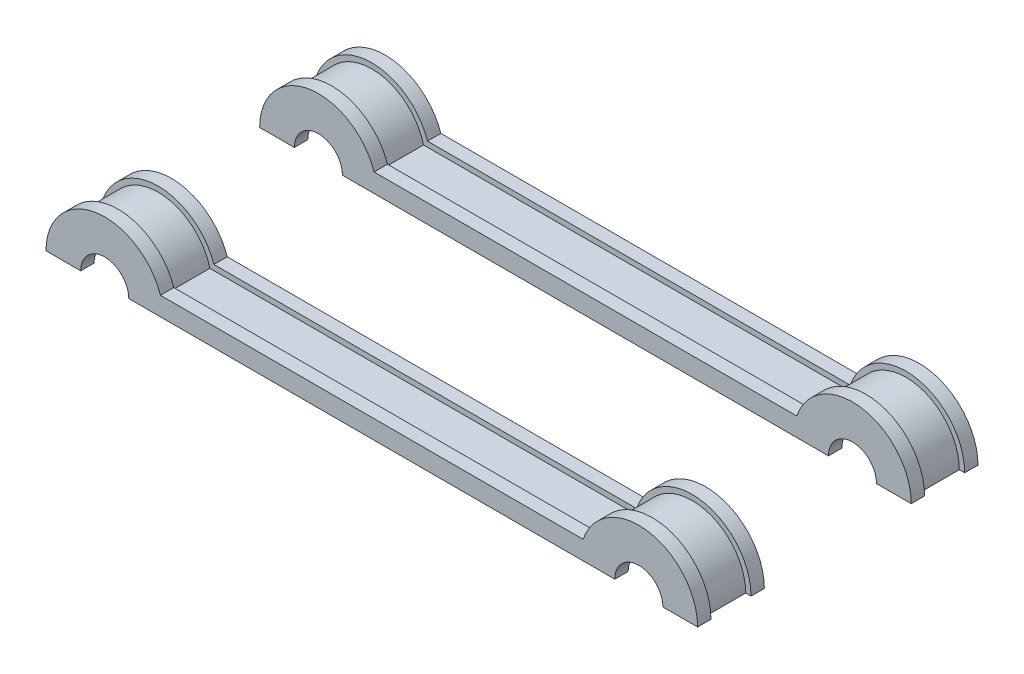
from build123d import *

# Parameters (mm, degrees)
BOSS_EXTRUDE1_DEPTH     = 47.5
CUT_EXTRUDE1_DEPTH      = 226.956301085
CUT_EXTRUDE1_DEPTH_BACK = 226.956301085
SKETCH3_W               = 80
SKETCH3_H               = 1000
BOSS_EXTRUDE2_START     = 5
BOSS_EXTRUDE2_DEPTH     = 5


with BuildPart() as part:
    # Sketch2 → Boss-Extrude1 (new, symmetric)
    with BuildSketch(Plane.XY):
        with BuildLine():
            Line((-20, 0), (-17, 0))
            ThreePointArc((-17, 0), (0, 17), (17, 0))
            Line((17, 0), (20, 0))
            ThreePointArc((20, 0), (19.840593925, 2.52008585), (19.364916731, 5))
            ThreePointArc((19.364916731, 5), (-2.52008585, 19.840593925), (-20, 0))
        make_face()
        with BuildLine():
            Line((180.635083269, 5), (19.364916731, 5))
            ThreePointArc((19.364916731, 5), (19.840593925, 2.52008585), (20, 0))
            Line((20, 0), (180, 0))
            ThreePointArc((180, 0), (180.159406075, 2.52008585), (180.635083269, 5))
        make_face()
        with BuildLine():
            ThreePointArc((220, 0), (202.52008585, 19.840593925), (180.635083269, 5))
            ThreePointArc((180.635083269, 5), (180.159406075, 2.52008585), (180, 0))
            Line((180, 0), (183, 0))
            ThreePointArc((183, 0), (200, 17), (217, 0))
            Line((217, 0), (220, 0))
        make_face()
    extrude(amount=BOSS_EXTRUDE1_DEPTH, both=True)

    # Sketch3 → Cut-Extrude1 (cut, two sides: drawn at the far end of the back side and taken through both)
    with BuildSketch(Plane(origin=(0, 0, 0), x_dir=(0, 0, -1), z_dir=(1, 0, 0)).offset(-CUT_EXTRUDE1_DEPTH_BACK)):
        with Locations((7.5, 0)):
            Rectangle(SKETCH3_W, SKETCH3_H)
    extrude(amount=CUT_EXTRUDE1_DEPTH + CUT_EXTRUDE1_DEPTH_BACK, mode=Mode.SUBTRACT)

    # Sketch4 → Boss-Extrude2 (add)
    with BuildSketch(Plane.XY.offset(47.5).offset(BOSS_EXTRUDE2_START)):
        with BuildLine():
            Line((179.143346385, 7), (20.856653615, 7))
            ThreePointArc((20.856653615, 7), (-3.546379878, 21.712282003), (-22, 0))
            Line((-22, 0), (-20, 0))
            ThreePointArc((-20, 0), (-2.52008585, 19.840593925), (19.364916731, 5))
            Line((19.364916731, 5), (180.635083269, 5))
            ThreePointArc((180.635083269, 5), (202.52008585, 19.840593925), (220, 0))
            Line((220, 0), (222, 0))
            ThreePointArc((222, 0), (203.546379878, 21.712282003), (179.143346385, 7))
        make_face()
        with BuildLine():
            Line((180.635083269, 5), (19.364916731, 5))
            ThreePointArc((19.364916731, 5), (-2.52008585, 19.840593925), (-20, 0))
            Line((-20, 0), (-17, 0))
            ThreePointArc((-17, 0), (0, 17), (17, 0))
            Line((17, 0), (183, 0))
            ThreePointArc((183, 0), (200, 17), (217, 0))
            Line((217, 0), (220, 0))
            ThreePointArc((220, 0), (202.52008585, 19.840593925), (180.635083269, 5))
        make_face()
        with BuildLine():
            ThreePointArc((9, 0), (0, 9), (-9, 0))
            Line((-9, 0), (-17, 0))
            ThreePointArc((-17, 0), (0, 17), (17, 0))
            Line((17, 0), (9, 0))
        make_face()
        with BuildLine():
            ThreePointArc((209, 0), (200, 9), (191, 0))
            Line((191, 0), (183, 0))
            ThreePointArc((183, 0), (200, 17), (217, 0))
            Line((217, 0), (209, 0))
        make_face()
    boss_extrude2 = extrude(amount=-BOSS_EXTRUDE2_DEPTH)

    # Mirror1: Boss-Extrude2 across plane
    add(boss_extrude2.mirror(Plane(origin=(0, 0, 40), x_dir=(1, 0, 0), z_dir=(0, 0, -1))))


with BuildPart() as body_2:
    # Mirror4: mirrored copy
    add(part.part.mirror(Plane.XY))


solid = Compound([part.part, body_2.part])
